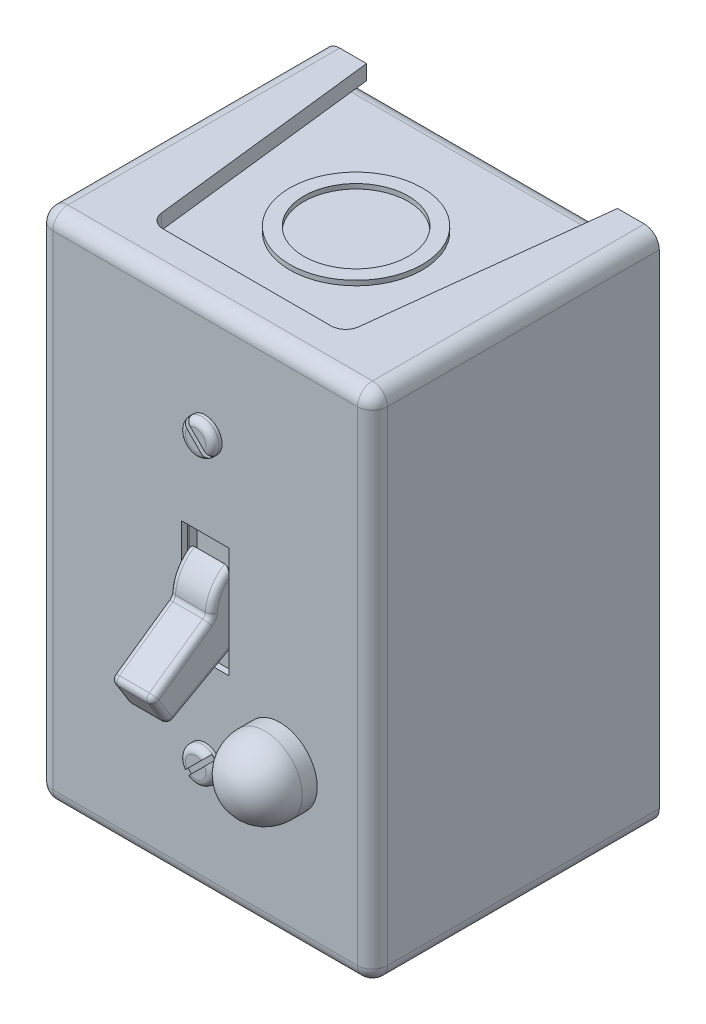
from build123d import *

# Parameters (mm, degrees)
SKETCH1_W               = 71.12
SKETCH1_H               = 109.22
BOSS_EXTRUDE1_DEPTH     = 60.96
FILLET1_R               = 3.175
CUT_EXTRUDE1_DEPTH      = 3.175
SKETCH3_R               = 14.097
SKETCH3_R_2             = 11.1125
BOSS_EXTRUDE5_DEPTH     = 1.016
SKETCH5_W               = 64.77
SKETCH5_H               = 102.87
SKETCH5_W_2             = 63.754
SKETCH5_H_2             = 101.854
CUT_EXTRUDE_THIN1_DEPTH = 53.975
SKETCH4_R               = 3.175
SKETCH4_R_2             = 11.1125
CUT_EXTRUDE3_DEPTH      = 1.016
FILLET6_R               = 3.175
SKETCH9_W               = 10.16
SKETCH9_H               = 23.495
CUT_EXTRUDE6_DEPTH      = 1.27
SKETCH10_W              = 9.525
SKETCH10_H              = 30.1625
CUT_EXTRUDE7_DEPTH      = 1.778
BOSS_EXTRUDE3_DEPTH     = 4.445
FILLET5_R               = 1.27
BODY_MOVE_COPY1_ANGLE   = 32
SKETCH15_R              = 3.57505
BOSS_EXTRUDE6_DEPTH     = 2.032
FILLET7_R               = 1.397
CUT_EXTRUDE_THIN2_DEPTH = 1.27


with BuildPart() as part:
    # Sketch1 → Boss-Extrude1 (new body)
    with BuildSketch(Plane.XY):
        Rectangle(SKETCH1_W, SKETCH1_H)
    extrude(amount=BOSS_EXTRUDE1_DEPTH)

    # Fillet1
    fillet1_edges = [part.edges().sort_by_distance(p)[0] for p in [
        (35.56, 0, 60.96),
        (0, 54.61, 60.96),
        (-35.56, 0, 60.96),
        (0, -54.61, 60.96),
        (-35.56, 54.61, 30.48),
        (35.56, 54.61, 30.48),
        (35.56, -54.61, 30.48),
        (-35.56, -54.61, 30.48),
    ]]
    fillet(fillet1_edges, radius=FILLET1_R)

    # Sketch2 → Cut-Extrude1 (cut)
    with BuildSketch(Plane(origin=(0, 54.61, 0), x_dir=(1, 0, 0), z_dir=(0, 1, 0))):
        with BuildLine():
            Line((-20.963003437, -49.260391385), (-26.67, 0))
            Line((-26.67, 0), (26.67, 0))
            Line((26.67, 0), (20.963003437, -49.260391385))
            ThreePointArc((20.963003437, -49.260391385), (19.921030118, -51.265732234), (17.809098851, -52.07))
            Line((17.809098851, -52.07), (-17.809098851, -52.07))
            ThreePointArc((-17.809098851, -52.07), (-19.921030118, -51.265732234), (-20.963003437, -49.260391385))
        make_face()
    cut_extrude1 = extrude(amount=-CUT_EXTRUDE1_DEPTH, mode=Mode.SUBTRACT)

    # Sketch3 → Boss-Extrude5 (add)
    with BuildSketch(Plane(origin=(0, 51.435, 0), x_dir=(1, 0, 0), z_dir=(0, 1, 0))):
        with Locations(Location((0, -28.8925, 0), (0, 0, 90))):
            Circle(SKETCH3_R)
        with Locations(Location((0, -28.8925, 0), (0, 0, 270))):
            Circle(SKETCH3_R_2, mode=Mode.SUBTRACT)
    boss_extrude5 = extrude(amount=BOSS_EXTRUDE5_DEPTH)

    # Mirror1: Cut-Extrude1, Boss-Extrude5 across plane
    add(cut_extrude1.mirror(Plane.ZX), mode=Mode.SUBTRACT)
    add(boss_extrude5.mirror(Plane.ZX))

    # Sketch5 → Cut-Extrude-Thin1 (cut)
    with BuildSketch(Plane(origin=(0, 0, 0), x_dir=(-1, 0, 0), z_dir=(0, 0, -1))):
        Rectangle(SKETCH5_W, SKETCH5_H)
        Rectangle(SKETCH5_W_2, SKETCH5_H_2, mode=Mode.SUBTRACT)
    extrude(amount=-CUT_EXTRUDE_THIN1_DEPTH, mode=Mode.SUBTRACT)


with BuildPart() as cut_extrude_thin1_piece_1:
    # of the separate pieces the step leaves, piece 1, a body of its own (cut_extrude_thin1_pieces)
    add(part.part.solids().sort_by_distance((-32.385, 54.61, 0))[0])

    # Sketch4 → Cut-Extrude3 (cut)
    with BuildSketch(Plane(origin=(0, 0, 0), x_dir=(-1, 0, 0), z_dir=(0, 0, -1))):
        with Locations((-20.32, 38.1)):
            Circle(SKETCH4_R)
        with Locations((20.32, 38.1)):
            Circle(SKETCH4_R)
        with Locations((20.32, -38.1)):
            Circle(SKETCH4_R)
        with Locations((0, 28.9687)):
            Circle(SKETCH4_R_2)
    extrude(amount=-CUT_EXTRUDE3_DEPTH, mode=Mode.SUBTRACT)

    # Fillet6
    fillet6_edges = [cut_extrude_thin1_piece_1.edges().sort_by_distance(p)[0] for p in [
        (0, 50.927, 0),
        (0, -50.927, 0),
    ]]
    fillet(fillet6_edges, radius=FILLET6_R)

    # Sketch9 → Cut-Extrude6 (cut)
    with BuildSketch(Plane.XY.offset(60.96)):
        Rectangle(SKETCH9_W, SKETCH9_H)
    extrude(amount=-CUT_EXTRUDE6_DEPTH, mode=Mode.SUBTRACT)

    # Sketch10 → Cut-Extrude7 (cut)
    with BuildSketch(Plane.XY.offset(59.69)):
        Rectangle(SKETCH10_W, SKETCH10_H)
    extrude(amount=-CUT_EXTRUDE7_DEPTH, mode=Mode.SUBTRACT)

    # Sketch15 → Boss-Extrude6 (add)
    with BuildSketch(Plane.XY.offset(60.96)):
        with Locations((0, 30.1625)):
            Circle(SKETCH15_R)
        with Locations((0, -30.1625)):
            Circle(SKETCH15_R)
    extrude(amount=BOSS_EXTRUDE6_DEPTH)

    # Fillet7
    fillet7_edges = [cut_extrude_thin1_piece_1.edges().sort_by_distance(p)[0] for p in [
        (-3.57505, 30.1625, 62.992),
        (-3.57505, -30.1625, 62.992),
    ]]
    fillet(fillet7_edges, radius=FILLET7_R)

    # Sketch16 → Cut-Extrude-Thin2 (cut)
    with BuildSketch(Plane.XY.offset(62.992)):
        Polygon((-5.537204514, 34.981284025), (4.818784025, 24.625295486), (5.537204514, 25.343715975), (-4.818784025, 35.699704514), align=None)
    cut_extrude_thin2 = extrude(amount=-CUT_EXTRUDE_THIN2_DEPTH, mode=Mode.SUBTRACT)

    # Mirror3: Cut-Extrude-Thin2 across plane
    add(cut_extrude_thin2.mirror(Plane.ZX), mode=Mode.SUBTRACT)

    # Sketch17 → Revolve1 (revolve)
    with BuildSketch(Plane(origin=(15.875, 0, 0), x_dir=(0, 0, -1), z_dir=(1, 0, 0)), mode=Mode.PRIVATE) as revolve1_sk:
        with BuildLine():
            Line((-60.96, -30.7975), (-64.135, -30.7975))
            ThreePointArc((-64.135, -30.7975), (-69.747660076, -28.472660076), (-72.0725, -22.86))
            Line((-72.0725, -22.86), (-60.96, -22.86))
            Line((-60.96, -22.86), (-60.96, -30.7975))
        make_face()
    revolve(revolve1_sk.sketch.rotate(Axis((15.875, -22.86, 60.96), (0, 0, 1)), 270), axis=Axis((15.875, -22.86, 60.96), (0, 0, 1)))


with BuildPart() as cut_extrude_thin1_piece_2:
    # of the separate pieces the step leaves, piece 2, a body of its own (cut_extrude_thin1_pieces)
    add(part.part.solids().sort_by_distance((0, 51.435, 14.7955))[0])


with BuildPart() as cut_extrude_thin1_piece_3:
    # of the separate pieces the step leaves, piece 3, a body of its own (cut_extrude_thin1_pieces)
    add(part.part.solids().sort_by_distance((0, -51.435, 14.7955))[0])


with BuildPart() as body_4:
    # Sketch11 → Boss-Extrude3 (new, symmetric)
    with BuildSketch(Plane(origin=(0, 0, 0), x_dir=(0, 0, -1), z_dir=(1, 0, 0))):
        with BuildLine():
            Line((-78.486, 3.81), (-78.486, -3.81))
            Line((-78.486, -3.81), (-62.811050749, -4.631489281))
            ThreePointArc((-62.811050749, -4.631489281), (-59.626669695, -7.660806406), (-55.372, -8.763))
            Line((-55.372, -8.763), (-55.372, 8.763))
            ThreePointArc((-55.372, 8.763), (-59.626669695, 7.660806406), (-62.811050749, 4.631489281))
            Line((-62.811050749, 4.631489281), (-78.486, 3.81))
        make_face()
    extrude(amount=BOSS_EXTRUDE3_DEPTH, both=True)

    # Fillet5
    fillet5_edges = [body_4.edges().sort_by_distance(p)[0] for p in [
        (4.445, -4.22074464, 70.648525374),
        (0, 4.631489281, 62.811050749),
        (0, -8.763, 55.372),
        (0, -4.631489281, 62.811050749),
        (0, -3.81, 78.486),
        (0, 3.81, 78.486),
        (4.445, -7.660806406, 59.626669695),
        (4.445, 0, 55.372),
        (4.445, 7.660806406, 59.626669695),
        (4.445, 4.22074464, 70.648525374),
        (-4.445, 7.660806406, 59.626669695),
        (-4.445, 0, 55.372),
        (-4.445, -7.660806406, 59.626669695),
        (4.445, 0, 78.486),
        (-4.445, -4.22074464, 70.648525374),
        (-4.445, 0, 78.486),
        (-4.445, 4.22074464, 70.648525374),
    ]]
    fillet(fillet5_edges, radius=FILLET5_R)


with BuildPart() as body_4_1:
    # Body-Move/Copy1: moved
    add(body_4.part.rotate(Axis((0, 0, 55.372), (1, 0, 0)), BODY_MOVE_COPY1_ANGLE))


solid = Compound([cut_extrude_thin1_piece_1.part, cut_extrude_thin1_piece_2.part, cut_extrude_thin1_piece_3.part, body_4_1.part])
